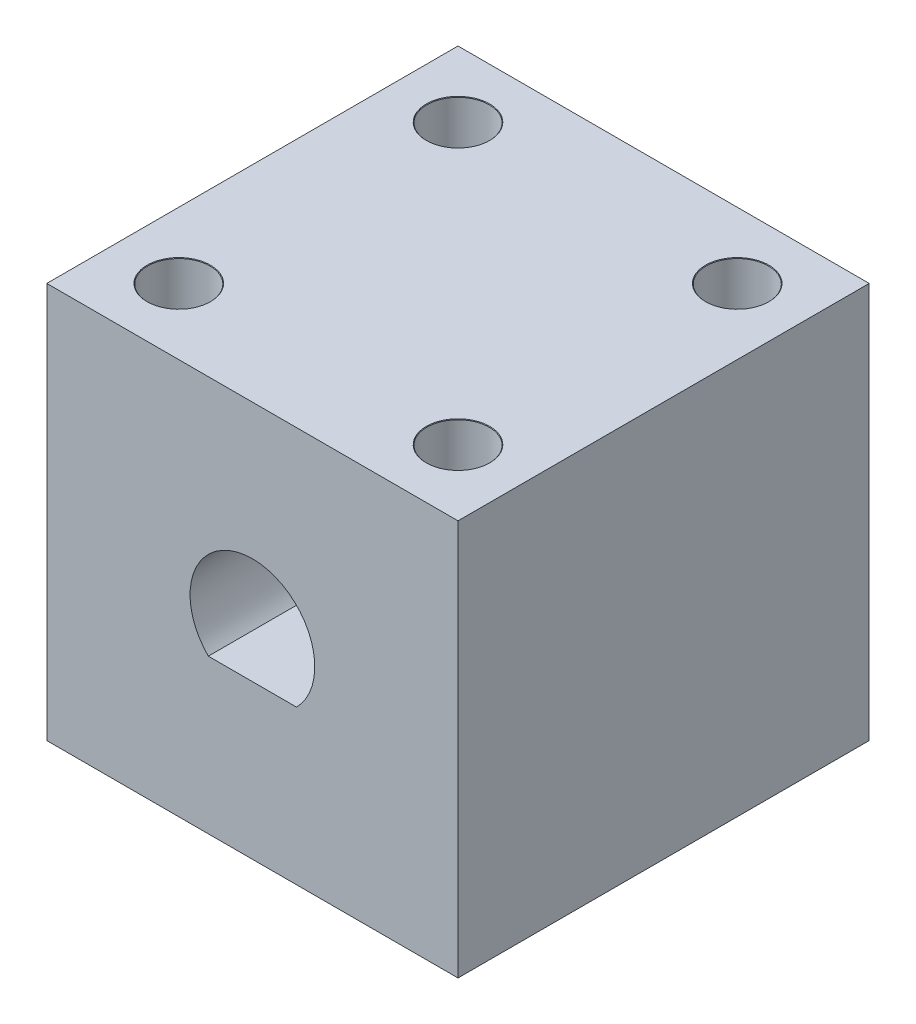
from build123d import *

# Parameters (mm, degrees)
BOSS_EXTRUDE1_START             = 47.625
SKETCH5_W                       = 19.785028842
SKETCH5_H                       = 19.785028843
BOSS_EXTRUDE1_DEPTH             = 19.05
F_3_0MM_DOWEL_HOLE1_D           = 3
F_3_0MM_DOWEL_HOLE1_DEPTH       = 25.4
F_3_0MM_DOWEL_HOLE1_CSINK_D     = 3.05
F_3_0MM_DOWEL_HOLE1_CSINK_ANGLE = 90
F_3_0MM_DOWEL_HOLE1_TIP         = 0.901290929
CUT_EXTRUDE1_DEPTH              = 594.535969939


with BuildPart() as part:
    # Sketch5 → Boss-Extrude1 (new body)
    with BuildSketch(Plane(origin=(0, 0, 0), x_dir=(1, 0, 0), z_dir=(0, 1, 0)).offset(BOSS_EXTRUDE1_START)):
        with Locations((482.6, 314.592485579)):
            Rectangle(SKETCH5_W, SKETCH5_H)
    extrude(amount=BOSS_EXTRUDE1_DEPTH)

    # Ø3.0mm Dowel Hole1
    with Locations(Plane(origin=(0, 66.675, 0), x_dir=(1, 0, 0), z_dir=(0, 1, 0))):
        with Locations((475.882485579, 321.31), (489.317514421, 321.31), (489.317514421, 307.874971157), (475.882485579, 307.874971157)):
            CounterSinkHole(F_3_0MM_DOWEL_HOLE1_D / 2, F_3_0MM_DOWEL_HOLE1_CSINK_D / 2, depth=F_3_0MM_DOWEL_HOLE1_DEPTH, counter_sink_angle=F_3_0MM_DOWEL_HOLE1_CSINK_ANGLE)
            with Locations((0, 0, -(F_3_0MM_DOWEL_HOLE1_DEPTH + F_3_0MM_DOWEL_HOLE1_TIP / 2))):  # 118° drill point
                Cone(0, F_3_0MM_DOWEL_HOLE1_D / 2, F_3_0MM_DOWEL_HOLE1_TIP, mode=Mode.SUBTRACT)

    # Sketch8 → Cut-Extrude1 (cut, through all)
    with BuildSketch(Plane.XY):
        with BuildLine():
            ThreePointArc((485.6, 57.15), (481.451949703, 59.921638598), (480.478679656, 55.028679656))
            Line((480.478679656, 55.028679656), (484.721320344, 55.028679656))
            ThreePointArc((484.721320344, 55.028679656), (485.371638598, 56.001949703), (485.6, 57.15))
        make_face()
    extrude(amount=-CUT_EXTRUDE1_DEPTH, mode=Mode.SUBTRACT)


solid = part.part
